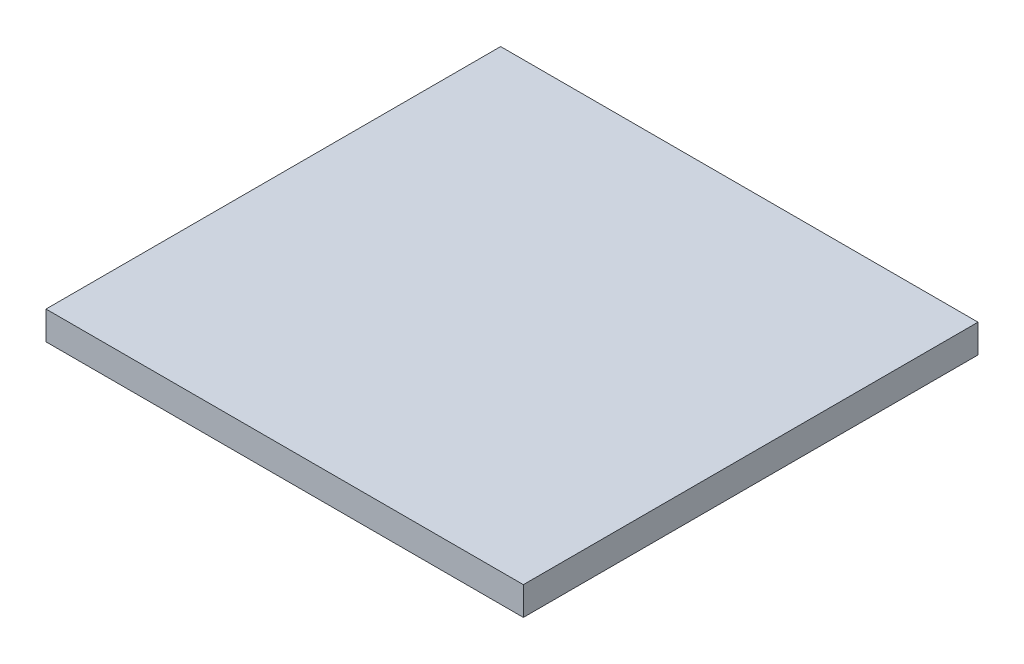
from build123d import *

# Parameters (mm, degrees)
SKETCH1_W           = 53.34
SKETCH1_H           = 50.8
BOSS_EXTRUDE1_DEPTH = 3.175


with BuildPart() as part:
    # Sketch1 → Boss-Extrude1 (new body)
    with BuildSketch(Plane(origin=(0, 0, 0), x_dir=(1, 0, 0), z_dir=(0, 1, 0))):
        with Locations((26.67, 25.4)):
            Rectangle(SKETCH1_W, SKETCH1_H)
    extrude(amount=BOSS_EXTRUDE1_DEPTH)


solid = part.part
